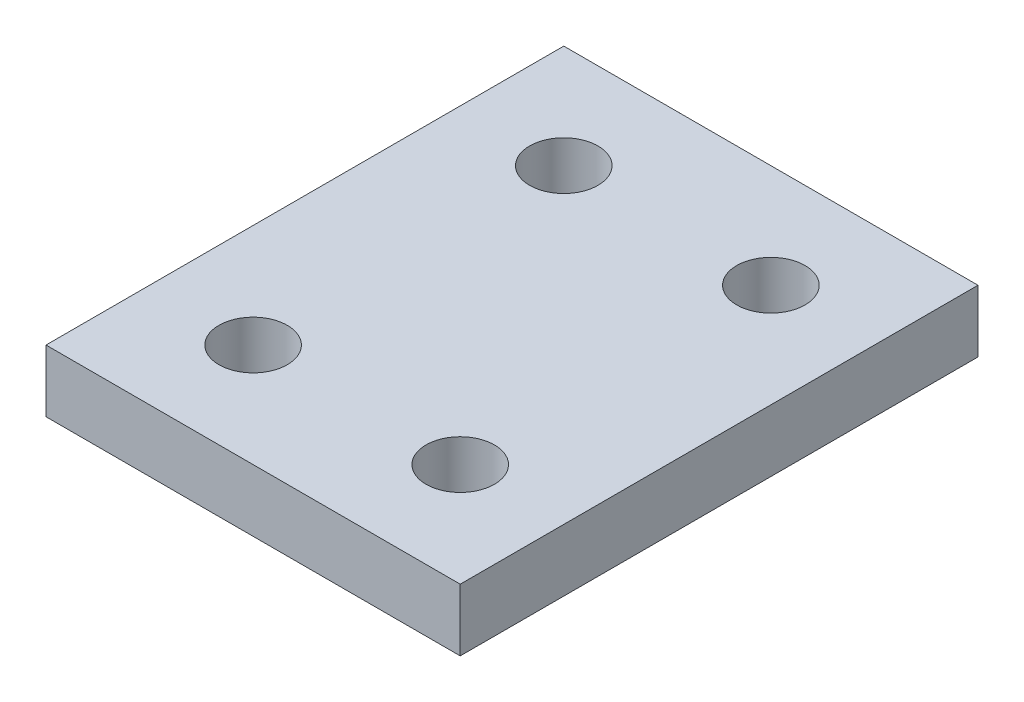
from build123d import *

# Parameters (mm, degrees)
SKETCH_1_W      = 20
SKETCH_1_H      = 25
EXTRUDE_1_DEPTH = 3
HOLE_WIZARD_1_D = 3.3


with BuildPart() as part:
    # 草图1 → 凸台-拉伸1 (new body)
    with BuildSketch(Plane(origin=(0, 0, 0), x_dir=(1, 0, 0), z_dir=(0, 1, 0))):
        Rectangle(SKETCH_1_W, SKETCH_1_H)
    extrude(amount=EXTRUDE_1_DEPTH)

    # 孔1 (through all)
    with Locations(Plane(origin=(0, 3, 0), x_dir=(1, 0, 0), z_dir=(0, 1, 0))):
        with Locations((-5, 7.5), (5, 7.5), (-5, -7.5), (5, -7.5)):
            Hole(HOLE_WIZARD_1_D / 2)


solid = part.part
